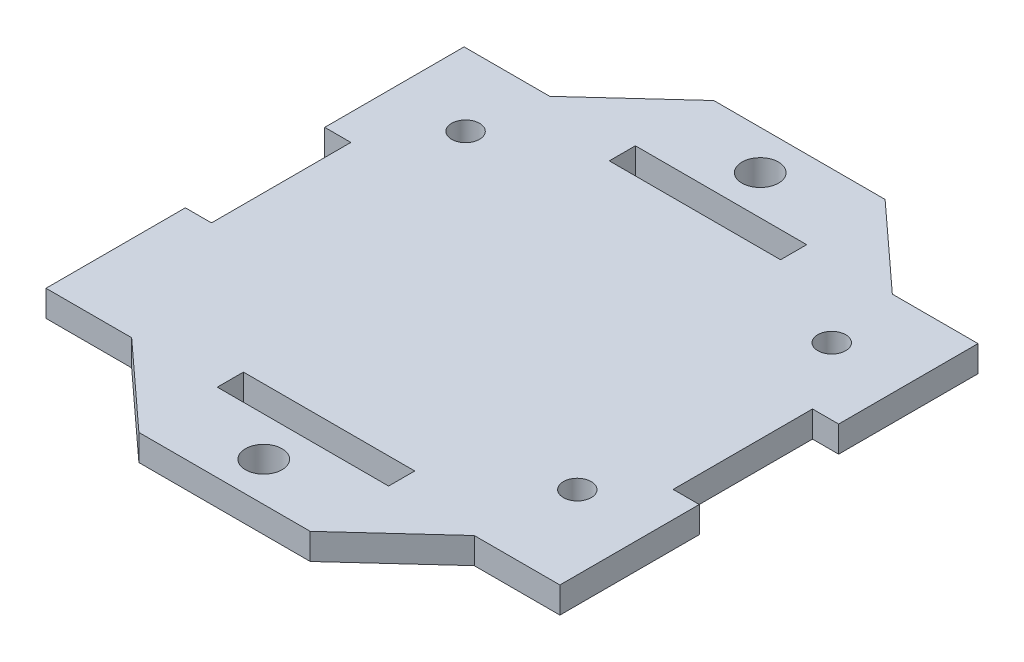
from build123d import *

# Parameters (mm, degrees)
SKETCH1_R           = 1.6
BOSS_EXTRUDE1_DEPTH = 3
SKETCH2_R           = 2.1
BOSS_EXTRUDE2_DEPTH = 3


with BuildPart() as part:
    # Sketch1 → Boss-Extrude1 (new body)
    with BuildSketch(Plane(origin=(0, 0, 0), x_dir=(1, 0, 0), z_dir=(0, 1, 0))):
        Polygon((-29.5, 24), (-29.5, 8), (-26.5, 8), (-26.5, -8), (-29.5, -8), (-29.5, -24), (-9.833333333, -24), (-9.833333333, -21), (9.833333333, -21), (9.833333333, -24), (29.5, -24), (29.5, -8), (26.5, -8), (26.5, 8), (29.5, 8), (29.5, 24), (9.833333333, 24), (9.833333333, 21), (-9.833333333, 21), (-9.833333333, 24), align=None)
        with Locations(Location((-21.0185, 15.69, 0), (0, 0, 270))):
            Circle(SKETCH1_R, mode=Mode.SUBTRACT)
        with Locations(Location((21.0185, 15.69, 0), (0, 0, 270))):
            Circle(SKETCH1_R, mode=Mode.SUBTRACT)
        with Locations(Location((21.0185, -13.52, 0), (0, 0, 270))):
            Circle(SKETCH1_R, mode=Mode.SUBTRACT)
    extrude(amount=BOSS_EXTRUDE1_DEPTH)

    # Sketch2 → Boss-Extrude2 (add)
    with BuildSketch(Plane(origin=(0, 3, 0), x_dir=(1, 0, 0), z_dir=(0, 1, 0))):
        Polygon((-19.666666667, 24), (-9.833333333, 33), (9.833333333, 33), (19.666666667, 24), align=None)
        with Locations(Location((0, 28.5, 0), (0, 0, 270))):
            Circle(SKETCH2_R, mode=Mode.SUBTRACT)
    boss_extrude2 = extrude(amount=-BOSS_EXTRUDE2_DEPTH)

    # Mirror1: Boss-Extrude2 across plane
    add(boss_extrude2.mirror(Plane.XY))


solid = part.part
